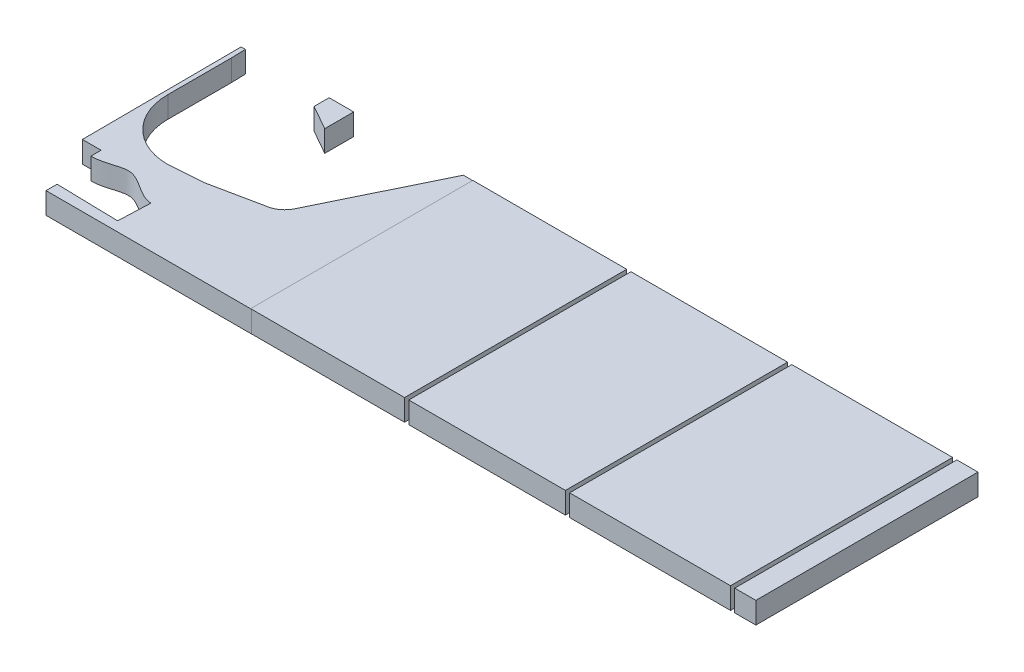
from build123d import *

# Parameters (mm, degrees)
SKETCH1_W             = 1196.683499022
SKETCH1_H             = 526.187924251
BOSS_EXTRUDE1_DEPTH   = 50.8
SKETCH2_W             = 10
SKETCH2_H             = 538.350737467
CUT_EXTRUDE5_DEPTH    = 912.930045105
BOSS_EXTRUDE2_DEPTH   = 50.8
BOSS_EXTRUDE2_2_DEPTH = 50.8


with BuildPart() as part:
    # Sketch1 → Boss-Extrude1 (new body)
    with BuildSketch(Plane(origin=(0, 0, 0), x_dir=(1, 0, 0), z_dir=(0, 1, 0))):
        with Locations((273.050289715, 0.935735331)):
            Rectangle(SKETCH1_W, SKETCH1_H)
    extrude(amount=BOSS_EXTRUDE1_DEPTH)

    # Sketch2 → Cut-Extrude5 (cut, through all)
    with BuildSketch(Plane(origin=(0, 50.8, 0), x_dir=(1, 0, 0), z_dir=(0, 1, 0))):
        with Locations((425.358540204, 0.779686245)):
            Rectangle(SKETCH2_W, SKETCH2_H)
        with Locations((44.358540204, 0.779686245)):
            Rectangle(SKETCH2_W, SKETCH2_H)
        with Locations((-330.291459796, 0.779686245)):
            Rectangle(SKETCH2_W, SKETCH2_H)
        with Locations((816.358540204, 0.779686245)):
            Rectangle(SKETCH2_W, SKETCH2_H)
    extrude(amount=-CUT_EXTRUDE5_DEPTH, mode=Mode.SUBTRACT)


with BuildPart() as cut_extrude5_piece_1:
    # of the separate pieces the step leaves, piece 1, a body of its own (cut_extrude5_pieces)
    add(part.part.solids().sort_by_distance((430.358540204, 0, 262.158226794))[0])


with BuildPart() as cut_extrude5_piece_2:
    # of the separate pieces the step leaves, piece 2, a body of its own (cut_extrude5_pieces)
    add(part.part.solids().sort_by_distance((49.358540204, 0, 262.158226794))[0])


with BuildPart() as cut_extrude5_piece_3:
    # of the separate pieces the step leaves, piece 3, a body of its own (cut_extrude5_pieces)
    add(part.part.solids().sort_by_distance((-325.291459796, 0, 262.158226794))[0])


with BuildPart() as cut_extrude5_piece_4:
    # of the separate pieces the step leaves, piece 4, a body of its own (cut_extrude5_pieces)
    add(part.part.solids().sort_by_distance((871.392039226, 0, 262.158226794))[0])


with BuildPart() as body_5:
    # Sketch3 → Boss-Extrude2 (new body)
    with BuildSketch(Plane(origin=(0, 0, 0), x_dir=(1, 0, 0), z_dir=(0, 1, 0))):
        with BuildLine():
            Line((-323.022309341, 263.51884305), (-323.022309341, -262.356983028))
            Line((-323.022309341, -262.356983028), (-809.749405531, -262.356983028))
            Line((-809.749405531, -262.356983028), (-809.749405531, -236.047842805))
            Line((-809.749405531, -236.047842805), (-662.985161767, -239.477626694))
            Line((-662.985161767, -239.477626694), (-659.829397565, -163.748236388))
            add(Edge.make_bspline(
                [(-827.305117277, -138.423193725), (-792.273117361, -138.423193725), (-743.797362049, -100.228210329), (-689.293747089, -162.520410056), (-659.829397565, -163.748236388)],
                knots=[0, 0, 0, 0, 0.467854577, 1, 1, 1, 1], degree=3))
            Line((-827.305117277, -138.423193725), (-827.305117277, -114.290321726))
            Line((-827.305117277, -114.290321726), (-871.641101875, -114.290321726))
            Line((-871.641101875, -114.290321726), (-873.441151591, 263.51884305))
            Line((-873.441151591, 263.51884305), (-863.411210196, 263.413235142))
            Line((-863.411210196, 263.413235142), (-862.397867535, 229.951182956))
            Line((-862.397867535, 229.951182956), (-862.397867535, 78.74))
            ThreePointArc((-862.397867535, 78.74), (-820.446801819, -22.580287127), (-719.150807137, -64.589976003))
            Line((-719.150807137, -64.589976003), (-642.631043373, -59.000143107))
            ThreePointArc((-642.631043373, -59.000143107), (-639.332387346, -58.650584514), (-636.063576939, -58.086491159))
            Line((-636.063576939, -58.086491159), (-513.339441144, -32.756452519))
            ThreePointArc((-513.339441144, -32.756452519), (-492.433794564, -23.115048161), (-477.930602029, -5.236006151))
            Line((-477.930602029, -5.236006151), (-347.129420906, 263.51884305))
            Line((-347.129420906, 263.51884305), (-323.022309341, 263.51884305))
        make_face()
    extrude(amount=BOSS_EXTRUDE2_DEPTH)


with BuildPart() as body_6:
    # Sketch3 → Boss-Extrude2 2 (new body)
    with BuildSketch(Plane(origin=(0, 0, 0), x_dir=(1, 0, 0), z_dir=(0, 1, 0))):
        Polygon((-606.766159206, 263.51884305), (-665.048893777, 263.51884305), (-665.048893777, 227.910987393), (-606.766159206, 194.877712853), align=None)
    extrude(amount=BOSS_EXTRUDE2_2_DEPTH)


solid = Compound([cut_extrude5_piece_1.part, cut_extrude5_piece_2.part, cut_extrude5_piece_3.part, cut_extrude5_piece_4.part, body_5.part, body_6.part])
